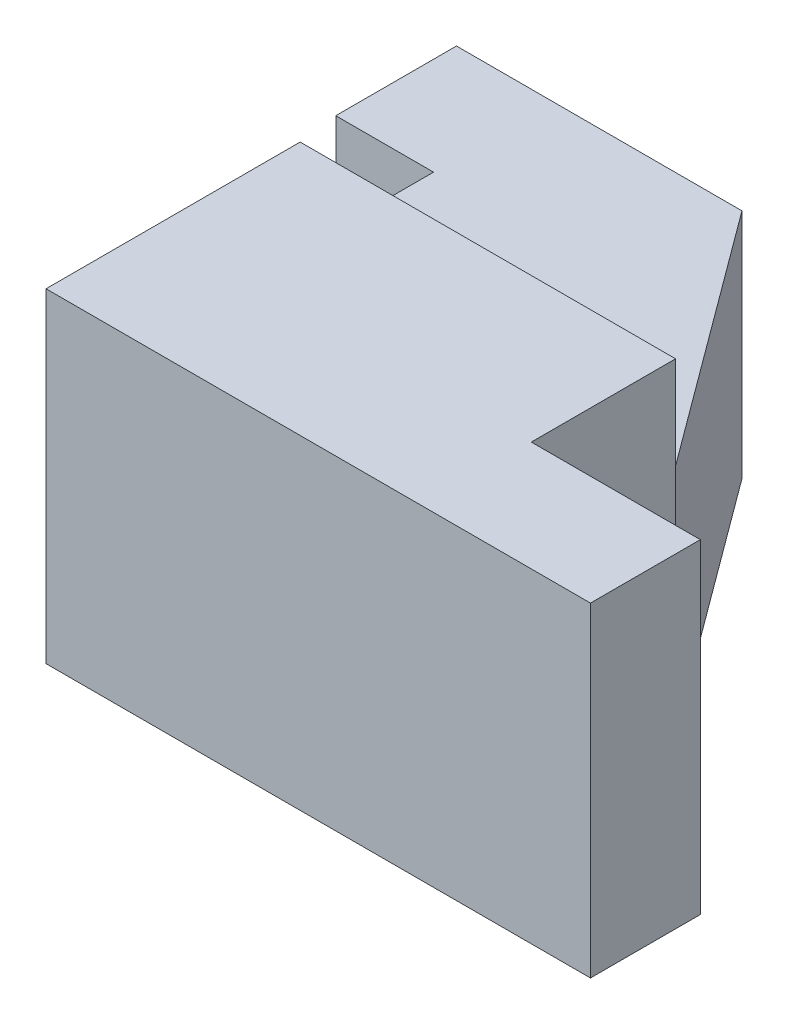
from build123d import *

# Parameters (mm, degrees)
BOSS_EXTRUDE1_DEPTH = 35
CUT_EXTRUDE1_DEPTH  = 10
BOSS_EXTRUDE2_DEPTH = 1


with BuildPart() as part:
    # Sketch1 → Boss-Extrude1 (new body)
    with BuildSketch(Plane(origin=(0, 0, 0), x_dir=(1, 0, 0), z_dir=(0, 1, 0))):
        Polygon((20.234168998, 54.781898059), (40.468337996, 27.39094903), (40.468337996, 11.84121787), (58.685596258, 11.84121787), (58.685596258, 0), (40.468337996, 0), (0, 0), (0, 41.769570729), (-10.539985137, 41.769570729), (-10.539985137, 54.781898059), (0, 54.781898059), align=None)
    extrude(amount=BOSS_EXTRUDE1_DEPTH)

    # Sketch2 → Cut-Extrude1 (cut)
    with BuildSketch(Plane(origin=(0, 35, 0), x_dir=(1, 0, 0), z_dir=(0, 1, 0))):
        Polygon((0, 27.39094903), (40.468337996, 27.39094903), (20.234168998, 54.781898059), (-10.539985137, 54.781898059), (-10.539985137, 41.769570729), (0, 41.769570729), align=None)
    extrude(amount=-CUT_EXTRUDE1_DEPTH, mode=Mode.SUBTRACT)

    # Sketch3 → Boss-Extrude2 (add)
    # profile 1 of 5: a face of its own
    with BuildSketch(Plane(origin=(40.468337996, 0, 0), x_dir=(0, 0, -1), z_dir=(1, 0, 0))):
        with BuildLine():
            Line((15.608012498, 25.318181818), (15.608012498, 26.3828125))
            add(Edge.make_bspline(
                [(15.608012498, 26.3828125), (15.613929091, 26.382309841), (15.628116005, 26.381104557), (15.652752461, 26.379888269), (15.684222971, 26.378149071), (15.722625164, 26.378258693), (15.767786844, 26.375208573), (15.819899458, 26.374332347), (15.878605829, 26.372746951), (15.967150762, 26.370972432), (16.08479696, 26.368081076), (16.23159955, 26.367557497), (16.383808007, 26.364605676), (16.538173624, 26.364195548), (16.686375461, 26.364664625), (16.821079515, 26.363412518), (16.938031542, 26.363679868), (17.01023791, 26.363650051), (17.043381816, 26.363636364)],
                knots=[0, 0, 0, 0, 0.198513801, 0.475999959, 0.824631156, 1.252128674, 1.759261781, 2.337292839, 2.994450419, 3.72282672, 5.298282345, 6.928903492, 8.630850825, 10.388057171, 12.089838844, 13.585844603, 14.891863097, 16, 16, 16, 16], degree=3))
            Line((17.043381816, 26.363636364), (17.698921589, 26.363636364))
            add(Edge.make_bspline(
                [(17.698921589, 26.363636364), (17.704840392, 26.363611169), (17.723072582, 26.36353356), (17.76023087, 26.364837574), (17.816828997, 26.363807194), (17.892803317, 26.366390766), (17.9882264, 26.366186183), (18.103274734, 26.368157778), (18.237983929, 26.369348265), (18.385946795, 26.370841938), (18.534393627, 26.371755913), (18.670744339, 26.37441097), (18.788649329, 26.375540632), (18.88808028, 26.377009351), (18.969049823, 26.378340257), (19.031783254, 26.3798237), (19.076073912, 26.380900137), (19.09949142, 26.38230229), (19.108012498, 26.3828125)],
                knots=[0, 0, 0, 0, 0.201587442, 0.620966849, 1.266046664, 2.128991623, 3.209530401, 4.515916572, 6.04806601, 7.797919325, 9.555835797, 11.10421633, 12.442854094, 13.571858957, 14.491239148, 15.201010182, 15.709266456, 16, 16, 16, 16], degree=3))
            add(Edge.make_bspline(
                [(19.108012498, 26.3828125), (19.107969078, 26.37570966), (19.107869193, 26.359370093), (19.108851628, 26.332151941), (19.109506877, 26.299007437), (19.110028585, 26.259934426), (19.111708231, 26.214729417), (19.113074993, 26.163591481), (19.114309944, 26.1067611), (19.117455901, 26.021305234), (19.121628692, 25.905299307), (19.127075683, 25.756604322), (19.134707274, 25.596371983), (19.143433747, 25.369509378), (19.157714184, 25.084278816), (19.170826437, 24.804668089), (19.181725763, 24.595896407), (19.187900945, 24.460221055), (19.193557613, 24.343978911), (19.197248338, 24.272963201), (19.198921589, 24.240767045)],
                knots=[0, 0, 0, 0, 0.178876762, 0.411492983, 0.685835487, 1.013830418, 1.395620461, 1.825090285, 2.302244024, 2.827254007, 3.978784499, 5.225871867, 6.574728645, 8.018899266, 10.943769838, 13.767392392, 15.06888389, 16.208996219, 17.188018586, 18, 18, 18, 18], degree=3))
            Line((19.198921589, 24.240767045), (18.380739771, 24.221590909))
            Line((18.380739771, 24.221590909), (18.357302271, 25.323153409))
            Line((18.357302271, 25.323153409), (17.608012498, 25.323153409))
            add(Edge.make_bspline(
                [(17.608012498, 25.323153409), (17.608227716, 25.310132206), (17.608713002, 25.280771151), (17.610071671, 25.231749785), (17.612998825, 25.17303214), (17.617430034, 25.105110077), (17.622409317, 25.028895271), (17.627634379, 24.944874649), (17.631373164, 24.853204215), (17.638554664, 24.718547362), (17.646203654, 24.538390311), (17.650992216, 24.391339688), (17.653467043, 24.315340909)],
                knots=[0, 0, 0, 0, 0.387240677, 0.873175431, 1.458138368, 2.135256309, 2.897125796, 3.729256101, 4.638343155, 5.625114967, 7.738969684, 10, 10, 10, 10], degree=3))
            Line((17.653467043, 24.315340909), (16.871506816, 24.300426136))
            Line((16.871506816, 24.300426136), (16.880739771, 25.323153409))
            Line((16.880739771, 25.323153409), (16.454603407, 25.323153409))
            add(Edge.make_bspline(
                [(16.454603407, 25.323153409), (16.384527377, 25.322477791), (16.245795629, 25.321140248), (16.037469323, 25.318520595), (15.825342018, 25.318090537), (15.681875989, 25.318150794), (15.608012498, 25.318181818)],
                knots=[0, 0, 0, 0, 0.993312589, 1.966492553, 2.953048609, 4, 4, 4, 4], degree=3))
        make_face()
    # profile 2 of 5: a face of its own
    with BuildSketch(Plane(origin=(40.468337996, 0, 0), x_dir=(0, 0, -1), z_dir=(1, 0, 0))):
        with BuildLine():
            Line((18.44608068, 22.386363636), (17.125057952, 22.386363636))
            add(Edge.make_bspline(
                [(17.125057952, 22.386363636), (17.110379654, 22.38640637), (17.076286679, 22.386505625), (17.017815078, 22.385489559), (16.945134375, 22.384881026), (16.857298472, 22.384338381), (16.752901761, 22.382577283), (16.62978839, 22.381492136), (16.487276847, 22.379043174), (16.332207621, 22.37713232), (16.177847778, 22.375254105), (16.037706086, 22.372696267), (15.917895944, 22.371939872), (15.818482758, 22.369252938), (15.738687842, 22.36815591), (15.678323163, 22.366643509), (15.636869331, 22.365583653), (15.615586379, 22.364147457), (15.608012498, 22.363636364)],
                knots=[0, 0, 0, 0, 0.464352648, 1.078542139, 1.850003055, 2.763759928, 3.85733811, 5.15311837, 6.658687364, 8.366454592, 10.059244011, 11.542346869, 12.800681911, 13.849460857, 14.688425178, 15.32521388, 15.759866476, 16, 16, 16, 16], degree=3))
            Line((15.608012498, 22.363636364), (15.608012498, 23.418323864))
            add(Edge.make_bspline(
                [(15.608012498, 23.418323864), (15.616059166, 23.417780679), (15.638047076, 23.4162964), (15.680232853, 23.416443808), (15.74057336, 23.414238084), (15.819189808, 23.414157073), (15.916012704, 23.413231855), (16.030834624, 23.412616103), (16.163883288, 23.411859275), (16.310900929, 23.41128959), (16.464071906, 23.410229776), (16.615352931, 23.410856376), (16.760473204, 23.409464615), (16.899443943, 23.410138939), (17.03225359, 23.408827799), (17.159149035, 23.409156032), (17.279887458, 23.409075961), (17.358249227, 23.409086018), (17.396364771, 23.409090909)],
                knots=[0, 0, 0, 0, 0.216408101, 0.591345622, 1.13158176, 1.836900011, 2.701062017, 3.730423251, 4.918630878, 6.272039408, 7.676279084, 9.029672699, 10.332250126, 11.571272449, 12.759480077, 13.89683903, 14.977012338, 16, 16, 16, 16], degree=3))
            Line((17.396364771, 23.409090909), (17.796932952, 23.409090909))
            add(Edge.make_bspline(
                [(17.796932952, 23.409090909), (17.817766627, 23.409022397), (17.862276115, 23.408876027), (17.933057015, 23.410135242), (18.01237086, 23.409511854), (18.099725289, 23.410690929), (18.195611989, 23.410981924), (18.29953114, 23.413008179), (18.411994531, 23.413086128), (18.529175489, 23.414911221), (18.644006532, 23.415853704), (18.749112936, 23.4182343), (18.840972717, 23.420254651), (18.91980287, 23.422498998), (18.985649514, 23.424212173), (19.03819009, 23.427242522), (19.077533458, 23.429730396), (19.099258627, 23.432231036), (19.108012498, 23.433238636)],
                knots=[0, 0, 0, 0, 0.762450879, 1.628915652, 2.590643466, 3.665041004, 4.82607808, 6.099835492, 7.468808806, 8.941827206, 10.388854792, 11.671421955, 12.789407829, 13.751486831, 14.557677909, 15.199765774, 15.67755616, 16, 16, 16, 16], degree=3))
            add(Edge.make_bspline(
                [(19.108012498, 23.433238636), (19.107959504, 23.33759362), (19.107856923, 23.152454224), (19.104712869, 22.883986257), (19.100816069, 22.633967568), (19.094420097, 22.402418027), (19.086181418, 22.189306422), (19.07516778, 21.994385842), (19.060385745, 21.817739732), (19.047877759, 21.706178581), (19.041961362, 21.653409091)],
                knots=[0, 0, 0, 0, 1.288127471, 2.493419436, 3.615907917, 4.655730358, 5.613022645, 6.488139192, 7.284875391, 8, 8, 8, 8], degree=3))
            add(Edge.make_bspline(
                [(19.041961362, 21.653409091), (19.033703622, 21.596224803), (19.017751147, 21.485754987), (18.982603691, 21.327547494), (18.940679578, 21.182177965), (18.889666365, 21.050445932), (18.831150591, 20.932881819), (18.764933141, 20.829996722), (18.690929114, 20.742475925), (18.609257103, 20.670420276), (18.520305289, 20.613800435), (18.423438036, 20.574869315), (18.320018984, 20.549403634), (18.248318619, 20.546789448), (18.21170568, 20.545454545)],
                knots=[0, 0, 0, 0, 1.365922432, 2.638717827, 3.829198653, 4.940607994, 5.974660658, 6.929670627, 7.827188068, 8.676177892, 9.496323936, 10.307265251, 11.135625128, 12, 12, 12, 12], degree=3))
            add(Edge.make_bspline(
                [(18.21170568, 20.545454545), (18.187779635, 20.546110163), (18.14053595, 20.547404727), (18.070434856, 20.554408428), (18.002183642, 20.56704426), (17.935966489, 20.586041982), (17.871032952, 20.608604955), (17.807501605, 20.636370338), (17.745829958, 20.66978044), (17.664809502, 20.72229462), (17.565483771, 20.799760436), (17.451391821, 20.909998586), (17.336695395, 21.035355456), (17.266971531, 21.129524355), (17.230881816, 21.178267045)],
                knots=[0, 0, 0, 0, 0.70860242, 1.399186127, 2.083909451, 2.760873109, 3.43711041, 4.118307733, 4.811519539, 5.51157439, 6.975533674, 8.532561923, 10.205222079, 12, 12, 12, 12], degree=3))
            add(Edge.make_bspline(
                [(17.230881816, 21.178267045), (17.225660708, 21.17354609), (17.213233377, 21.162309229), (17.192235652, 21.142579275), (17.165932369, 21.117747451), (17.134674649, 21.087676399), (17.097729617, 21.05313913), (17.055638177, 21.013077727), (17.008275546, 20.967874425), (16.957488043, 20.918988619), (16.906327735, 20.870253617), (16.859273766, 20.824009607), (16.816191944, 20.783541951), (16.778543641, 20.747323829), (16.746321328, 20.715619787), (16.718827155, 20.688900796), (16.696378276, 20.667076914), (16.676877677, 20.648465719), (16.657910589, 20.630016313), (16.635365065, 20.6095015), (16.609408987, 20.583334944), (16.577081961, 20.554152507), (16.541494135, 20.519157728), (16.500392266, 20.480733537), (16.455246386, 20.437321344), (16.406519896, 20.391598126), (16.358338934, 20.346022046), (16.31332966, 20.303911457), (16.273370541, 20.266687694), (16.238324545, 20.234498384), (16.208523823, 20.207474517), (16.183669016, 20.185452706), (16.16388124, 20.168278872), (16.152069538, 20.158826465), (16.147074998, 20.154829545)],
                knots=[0, 0, 0, 0, 0.453260903, 1.078855762, 1.855294354, 2.782600182, 3.871831201, 5.111919743, 6.52443217, 8.087824814, 9.651217459, 11.074302669, 12.335943427, 13.457240684, 14.43825364, 15.246803848, 15.926011208, 16.454327047, 16.982642886, 17.629784787, 18.416777542, 19.35516983, 20.433356532, 21.630341421, 22.978193347, 24.466418285, 25.933092985, 27.248924439, 28.435476401, 29.44968627, 30.313140472, 31.025906851, 31.58810781, 32, 32, 32, 32], degree=3))
            Line((16.147074998, 20.154829545), (15.471648862, 21.049005682))
            add(Edge.make_bspline(
                [(15.471648862, 21.049005682), (15.476852407, 21.052090382), (15.48918011, 21.059398334), (15.510456444, 21.071725659), (15.535696611, 21.089549943), (15.567405485, 21.108836882), (15.603572038, 21.133440926), (15.644922263, 21.161489538), (15.691699074, 21.193011129), (15.762984389, 21.242088753), (15.863148112, 21.310129742), (15.994273987, 21.400480476), (16.140624651, 21.500558862), (16.297507552, 21.607569837), (16.455728323, 21.715886786), (16.605788518, 21.819846967), (16.744682703, 21.913852215), (16.870260561, 22.000800953), (16.983720357, 22.078948538), (17.085282169, 22.147845931), (17.174680993, 22.207650368), (17.230607367, 22.243902098), (17.256449998, 22.260653409)],
                knots=[0, 0, 0, 0, 0.168252897, 0.398607381, 0.683485362, 1.026877551, 1.430454691, 1.899787115, 2.416597896, 2.999182639, 4.30678114, 5.784265691, 7.427915257, 9.237732375, 11.065853569, 12.760705164, 14.314837979, 15.730266824, 17.008695889, 18.146418312, 19.143491246, 20, 20, 20, 20], degree=3))
            add(Edge.make_bspline(
                [(17.256449998, 22.260653409), (17.284176368, 22.21638909), (17.341678798, 22.124588187), (17.42565576, 22.015962858), (17.499952535, 21.930377744), (17.562740519, 21.872614024), (17.626797546, 21.818065883), (17.694753232, 21.770539789), (17.765038044, 21.73109361), (17.837756767, 21.703223746), (17.911573223, 21.685051911), (17.961602768, 21.682894542), (17.986563634, 21.681818182)],
                knots=[0, 0, 0, 0, 1.612164336, 3.34350889, 4.234197125, 5.108257032, 5.975070848, 6.830962957, 7.66535157, 8.456905229, 9.230115291, 10, 10, 10, 10], degree=3))
            add(Edge.make_bspline(
                [(17.986563634, 21.681818182), (18.002444608, 21.682488866), (18.033886054, 21.683816698), (18.080041479, 21.690583862), (18.124205757, 21.703654823), (18.165831408, 21.722430422), (18.206331881, 21.745014164), (18.243912454, 21.774112452), (18.280254561, 21.80720654), (18.31383616, 21.846048185), (18.344840196, 21.890500999), (18.371672891, 21.941825998), (18.394205337, 22.000059785), (18.413576579, 22.064547444), (18.427098518, 22.136025911), (18.437950523, 22.213504541), (18.444081011, 22.297728658), (18.445396822, 22.356051767), (18.44608068, 22.386363636)],
                knots=[0, 0, 0, 0, 0.807394901, 1.598495405, 2.363559583, 3.139143183, 3.915006591, 4.713752514, 5.54803119, 6.409194542, 7.316825283, 8.296157079, 9.343807513, 10.485636333, 11.712384095, 13.03592979, 14.459504163, 16, 16, 16, 16], degree=3))
        make_face()
    # profile 3 of 5: a face of its own
    with BuildSketch(Plane(origin=(40.468337996, 0, 0), x_dir=(0, 0, -1), z_dir=(1, 0, 0))):
        with BuildLine():
            add(Edge.make_bspline(
                [(15.517103407, 18.03125), (15.517940274, 18.08170112), (15.519581106, 18.180619881), (15.531899652, 18.325757517), (15.551675816, 18.464995031), (15.579308171, 18.598038922), (15.613952583, 18.725680708), (15.657471299, 18.846772791), (15.7076418, 18.962425734), (15.766320576, 19.071253818), (15.830881112, 19.173468497), (15.898919359, 19.270079483), (15.972421507, 19.359219588), (16.0507434, 19.441269066), (16.132099585, 19.518097838), (16.21946252, 19.586107535), (16.31049671, 19.648142505), (16.405429851, 19.703466149), (16.503324102, 19.751278659), (16.602139802, 19.79338159), (16.70193601, 19.829128496), (16.802563413, 19.858082926), (16.904030092, 19.881040328), (17.006468421, 19.897579935), (17.109979433, 19.906634536), (17.179256209, 19.908273036), (17.213836362, 19.909090909)],
                knots=[0, 0, 0, 0, 1.28183837, 2.513281471, 3.698361429, 4.853378881, 5.96399271, 7.056157584, 8.120176888, 9.164422389, 10.194238543, 11.190747931, 12.165095003, 13.126768987, 14.071702403, 15.005579982, 15.936605072, 16.869319423, 17.79478913, 18.703169829, 19.597458161, 20.486572167, 21.362213815, 22.239445119, 23.121202505, 24, 24, 24, 24], degree=3))
            add(Edge.make_bspline(
                [(17.213836362, 19.909090909), (17.275234416, 19.907399981), (17.397818268, 19.904023969), (17.580681341, 19.878267852), (17.761288551, 19.836348194), (17.939028571, 19.777818513), (18.112166223, 19.704234302), (18.276994462, 19.611418833), (18.433946478, 19.503406843), (18.556255733, 19.399329135), (18.648358484, 19.308042492), (18.71501133, 19.235446403), (18.776992423, 19.157899127), (18.836612889, 19.076923535), (18.890970143, 18.990645956), (18.94217436, 18.90035625), (18.989889922, 18.805917285), (19.032995438, 18.707183691), (19.072189457, 18.60490861), (19.106438945, 18.499022437), (19.134638764, 18.389358881), (19.158045657, 18.276299611), (19.176648725, 18.159966772), (19.189165631, 18.039990366), (19.197180448, 17.916775733), (19.198337163, 17.833345837), (19.198921589, 17.791193182)],
                knots=[0, 0, 0, 0, 1.359376484, 2.714053505, 4.081213128, 5.460652739, 6.853349966, 8.240519594, 9.642492163, 11.067036843, 11.789972542, 12.513668307, 13.248146964, 13.987474949, 14.739429328, 15.504843748, 16.285636076, 17.081491963, 17.889669369, 18.710402, 19.544605276, 20.395996977, 21.266576569, 22.152430652, 23.066522233, 24, 24, 24, 24], degree=3))
            add(Edge.make_bspline(
                [(19.198921589, 17.791193182), (19.197666278, 17.720584891), (19.195208202, 17.582323865), (19.172826641, 17.38041171), (19.136159889, 17.188846136), (19.08434078, 17.008498714), (19.019315358, 16.839678757), (18.940495123, 16.68357516), (18.846631689, 16.541651702), (18.740566926, 16.412039825), (18.620896599, 16.29667805), (18.488039387, 16.195563002), (18.342579266, 16.108946862), (18.185315473, 16.036340608), (18.016685799, 15.979573189), (17.838106587, 15.938393439), (17.649164534, 15.914065961), (17.520015798, 15.910775557), (17.45389318, 15.909090909)],
                knots=[0, 0, 0, 0, 1.16585083, 2.282900924, 3.350337473, 4.383693547, 5.377746439, 6.33427132, 7.265832067, 8.182503293, 9.095045688, 10.004550602, 10.93395893, 11.88567672, 12.860024833, 13.867308716, 14.908087409, 16, 16, 16, 16], degree=3))
            add(Edge.make_bspline(
                [(17.45389318, 15.909090909), (17.402219324, 15.910551139), (17.297297333, 15.913516086), (17.13841241, 15.935160657), (16.976134922, 15.969558722), (16.811312555, 16.016377912), (16.647096968, 16.0793714), (16.487074838, 16.159921788), (16.332162918, 16.257601896), (16.207781377, 16.351090544), (16.112551434, 16.435764182), (16.043792535, 16.505092059), (15.978898858, 16.580342219), (15.917044611, 16.660745699), (15.858247452, 16.74657286), (15.802614157, 16.83776323), (15.75100331, 16.934412689), (15.702526855, 17.03616061), (15.658235565, 17.143016506), (15.621010431, 17.255454689), (15.58876115, 17.372512633), (15.562693287, 17.494672025), (15.542177778, 17.6219707), (15.527226265, 17.753963194), (15.518697535, 17.890983993), (15.517641658, 17.983889729), (15.517103407, 18.03125)],
                knots=[0, 0, 0, 0, 1.153726157, 2.342601393, 3.57440572, 4.856137659, 6.164886377, 7.495996181, 8.849913256, 10.249867543, 10.965067063, 11.694046249, 12.42862093, 13.182573326, 13.958305526, 14.750755785, 15.566786036, 16.40391613, 17.266890041, 18.147941351, 19.047017458, 19.97714216, 20.935811673, 21.925397031, 22.942436042, 24, 24, 24, 24], degree=3))
        make_face()
        with BuildLine():
            add(Edge.make_bspline(
                [(16.28983068, 17.9765625), (16.291116932, 17.933811367), (16.293634162, 17.85014625), (16.319698973, 17.728993837), (16.360044769, 17.615352415), (16.41727662, 17.510362121), (16.490234676, 17.414877143), (16.579571206, 17.331215163), (16.683804296, 17.259085271), (16.802981991, 17.198539637), (16.936740559, 17.150328195), (17.085406333, 17.117038362), (17.247535346, 17.095384361), (17.360542495, 17.092436429), (17.419092043, 17.090909091)],
                knots=[0, 0, 0, 0, 0.949481319, 1.858160486, 2.742520531, 3.6236775, 4.50615479, 5.403768841, 6.334153748, 7.316072402, 8.36866591, 9.487453869, 10.69823774, 12, 12, 12, 12], degree=3))
            add(Edge.make_bspline(
                [(17.419092043, 17.090909091), (17.458404396, 17.091695514), (17.534772139, 17.093223212), (17.645909925, 17.102009015), (17.749493304, 17.118645263), (17.846207083, 17.14000731), (17.935298391, 17.169628069), (18.017903548, 17.204162387), (18.09385015, 17.244613529), (18.1623221, 17.291725157), (18.223753088, 17.344573606), (18.27810675, 17.402421484), (18.323149496, 17.466906067), (18.361012587, 17.535565126), (18.389988073, 17.60944569), (18.411737682, 17.68715259), (18.423584836, 17.769285188), (18.425314975, 17.825249414), (18.426194316, 17.853693182)],
                knots=[0, 0, 0, 0, 1.323040814, 2.570124481, 3.747579329, 4.851049144, 5.899061945, 6.902241681, 7.861040494, 8.789130643, 9.69297001, 10.583653176, 11.452331861, 12.332910808, 13.216080545, 14.116719351, 15.042824278, 16, 16, 16, 16], degree=3))
            add(Edge.make_bspline(
                [(18.426194316, 17.853693182), (18.42514485, 17.886912744), (18.42308394, 17.95214836), (18.405614614, 18.047183319), (18.377029557, 18.137219638), (18.336812227, 18.221483376), (18.288129118, 18.30087253), (18.228814837, 18.372605124), (18.162976475, 18.439438287), (18.087457301, 18.497938392), (18.006060823, 18.551522609), (17.917469713, 18.597354129), (17.823577475, 18.63740214), (17.723946589, 18.669882557), (17.619899653, 18.695214024), (17.512168702, 18.713610953), (17.401129851, 18.725492444), (17.325846173, 18.726674022), (17.287699998, 18.727272727)],
                knots=[0, 0, 0, 0, 0.995052497, 1.954055351, 2.885355509, 3.818600041, 4.746026368, 5.669180887, 6.602452395, 7.552195931, 8.526435441, 9.519892673, 10.537362681, 11.583045513, 12.656973621, 13.74422849, 14.857002533, 16, 16, 16, 16], degree=3))
            add(Edge.make_bspline(
                [(17.287699998, 18.727272727), (17.236984718, 18.726038739), (17.138750156, 18.723648527), (16.996752123, 18.705495183), (16.866005295, 18.673561701), (16.746942138, 18.629476179), (16.639881502, 18.575301094), (16.546794912, 18.510285613), (16.467340119, 18.436383369), (16.402359107, 18.353924748), (16.353107882, 18.264611047), (16.315733108, 18.172114094), (16.293955922, 18.075343768), (16.291209276, 18.009573767), (16.28983068, 17.9765625)],
                knots=[0, 0, 0, 0, 1.307009708, 2.531653726, 3.681609407, 4.768627752, 5.797501532, 6.765819063, 7.685379574, 8.585045165, 9.459269499, 10.305729446, 11.149612041, 12, 12, 12, 12], degree=3))
        make_face(mode=Mode.SUBTRACT)
    # profile 4 of 5: a face of its own
    with BuildSketch(Plane(origin=(40.468337996, 0, 0), x_dir=(0, 0, -1), z_dir=(1, 0, 0))):
        with BuildLine():
            Line((15.608012498, 14.364346591), (15.64139318, 15.363636364))
            add(Edge.make_bspline(
                [(15.64139318, 15.363636364), (15.64754927, 15.363173016), (15.66246881, 15.362050075), (15.688482265, 15.359778566), (15.722110343, 15.357728437), (15.76308957, 15.355789551), (15.81138439, 15.352906577), (15.866988743, 15.349100751), (15.930233929, 15.345901436), (16.002398249, 15.341135576), (16.085788204, 15.337417201), (16.182786383, 15.331005235), (16.295067888, 15.326060931), (16.422374555, 15.318289416), (16.564715201, 15.311823654), (16.721876592, 15.302860727), (16.894233716, 15.293790537), (17.077941546, 15.284002741), (17.264962822, 15.274191542), (17.447752414, 15.265195694), (17.622444238, 15.255735711), (17.789110674, 15.247200691), (17.947517429, 15.239667769), (18.097581867, 15.231497537), (18.239421729, 15.224765382), (18.373151517, 15.21732441), (18.499121499, 15.211143255), (18.617498924, 15.204839845), (18.728260345, 15.198092933), (18.831307342, 15.193000542), (18.926656292, 15.186134084), (19.014485715, 15.180431492), (19.095042281, 15.175914977), (19.146134945, 15.171737496), (19.170512498, 15.169744318)],
                knots=[0, 0, 0, 0, 0.167676778, 0.406371642, 0.709201878, 1.082646866, 1.520650238, 2.0232283, 2.596410566, 3.240578038, 3.987468014, 4.863474759, 5.880733751, 7.039938482, 8.32756719, 9.750715039, 11.315466379, 13.015400921, 14.747441742, 16.402093077, 17.98610754, 19.4991524, 20.934810566, 22.293406424, 23.581035132, 24.791604912, 25.931204891, 27.006591682, 28.011356954, 28.945141018, 29.808717123, 30.607708537, 31.335703875, 32, 32, 32, 32], degree=3))
            Line((19.170512498, 15.169744318), (19.198921589, 15.119318182))
            add(Edge.make_bspline(
                [(19.198921589, 15.119318182), (19.181633863, 15.095884806), (19.145652996, 15.047113023), (19.089601852, 14.970900472), (19.028444443, 14.889457884), (18.963080039, 14.802118315), (18.893804906, 14.70888944), (18.818601278, 14.611059704), (18.74039616, 14.506471567), (18.65786716, 14.399459306), (18.576231018, 14.292837688), (18.498982137, 14.190496295), (18.426900865, 14.09528378), (18.358573336, 14.00805194), (18.297632641, 13.9262565), (18.240453502, 13.852612704), (18.189191079, 13.785529779), (18.126382808, 13.703253689), (18.046352746, 13.599874611), (17.946761062, 13.467046907), (17.8355907, 13.32369984), (17.739251487, 13.196905876), (17.660458103, 13.093890297), (17.603331101, 13.020027282), (17.550647438, 12.950448951), (17.500123261, 12.886441754), (17.454753701, 12.826168966), (17.411599449, 12.771425932), (17.372827017, 12.72101131), (17.347854296, 12.68914032), (17.335995452, 12.674005682)],
                knots=[0, 0, 0, 0, 0.795699866, 1.656086663, 2.585020285, 3.578642756, 4.636954084, 5.758686611, 6.95026262, 8.205294126, 9.451256907, 10.61955005, 11.70893892, 12.714305286, 13.647127416, 14.495909, 15.261865009, 15.954066554, 17.324265588, 18.834124659, 20.490274414, 22.280930696, 23.185326978, 24.034108562, 24.832407431, 25.569974464, 26.262176009, 26.893647116, 27.474624103, 28, 28, 28, 28], degree=3))
            add(Edge.make_bspline(
                [(17.335995452, 12.674005682), (17.370323051, 12.674023419), (17.441582411, 12.67406024), (17.552379466, 12.67376096), (17.670747642, 12.675018582), (17.837418135, 12.674379429), (18.047171811, 12.676161913), (18.254796117, 12.677697626), (18.415068295, 12.679608695), (18.528463169, 12.681273825), (18.635948625, 12.681764529), (18.76923432, 12.68269976), (18.925954505, 12.684305682), (19.048826467, 12.684064863), (19.108012498, 12.683948864)],
                knots=[0, 0, 0, 0, 0.697377994, 1.447660525, 2.250861994, 3.102144097, 4.833592042, 6.512170744, 7.32022457, 8.089805231, 8.816056171, 9.503831974, 10.797624148, 12, 12, 12, 12], degree=3))
            Line((19.108012498, 12.683948864), (19.081734089, 11.681818182))
            add(Edge.make_bspline(
                [(19.081734089, 11.681818182), (19.022781424, 11.685787675), (18.906289968, 11.693631459), (18.757896418, 11.704450081), (18.629287379, 11.712609422), (18.511935411, 11.721697471), (18.372921617, 11.730506132), (18.245546863, 11.738919483), (18.13950598, 11.746308649), (18.063994461, 11.751437756), (17.995059872, 11.755262683), (17.932635899, 11.760296176), (17.876659979, 11.762120535), (17.827519289, 11.766626494), (17.785077411, 11.768140434), (17.746985757, 11.770688828), (17.708615048, 11.772753452), (17.665323526, 11.775886109), (17.614864597, 11.778419642), (17.557343739, 11.782106737), (17.492707654, 11.786290151), (17.420772618, 11.791547948), (17.34166243, 11.796172096), (17.286513311, 11.799906861), (17.257870452, 11.801846591)],
                knots=[0, 0, 0, 0, 2.133500422, 4.215832645, 5.372424945, 6.786632107, 8.465794967, 10.401978326, 11.395945206, 12.304046614, 13.134823775, 13.888827282, 14.565014015, 15.156398484, 15.669941714, 16.098129129, 16.534849873, 17.057420646, 17.665317708, 18.359054026, 19.138645208, 20.004102219, 20.963388358, 22, 22, 22, 22], degree=3))
            add(Edge.make_bspline(
                [(17.257870452, 11.801846591), (17.204367997, 11.80494767), (17.103760921, 11.810778999), (16.961954769, 11.818646899), (16.838848951, 11.825066314), (16.728514077, 11.830245806), (16.620063774, 11.835260468), (16.501980546, 11.842180414), (16.368423737, 11.848141799), (16.249116688, 11.854047633), (16.151088962, 11.858446057), (16.081511863, 11.862284423), (16.017569454, 11.864893632), (15.959328885, 11.867720629), (15.907028649, 11.870698368), (15.860392222, 11.872945628), (15.819653976, 11.874124087), (15.752656209, 11.877000801), (15.660300567, 11.880990081), (15.579599128, 11.885568303), (15.540540907, 11.887784091)],
                knots=[0, 0, 0, 0, 1.68303769, 3.16481741, 4.460198397, 5.554349413, 6.633647931, 7.869633905, 9.268973177, 10.832046056, 11.62100894, 12.350565028, 13.020355727, 13.63073256, 14.181709417, 14.665484526, 15.096958033, 15.461565563, 16.771437837, 18, 18, 18, 18], degree=3))
            Line((15.540540907, 11.887784091), (15.517103407, 11.938210227))
            add(Edge.make_bspline(
                [(15.517103407, 11.938210227), (15.545117733, 11.979277192), (15.605081384, 12.067179544), (15.704438689, 12.205309667), (15.81609742, 12.360251863), (15.942454472, 12.529060016), (16.080367506, 12.71149224), (16.228641298, 12.905805503), (16.386398848, 13.110995134), (16.522618507, 13.287717853), (16.633997744, 13.430075393), (16.713945289, 13.534845677), (16.791317975, 13.63431561), (16.866232562, 13.728373387), (16.936387509, 13.819066957), (17.003756078, 13.904663528), (17.067639932, 13.985658749), (17.127607033, 14.061123333), (17.182501789, 14.129850892), (17.230529837, 14.190905694), (17.271975392, 14.242789298), (17.305915784, 14.285995316), (17.332906246, 14.320509447), (17.353709733, 14.345543035), (17.366395616, 14.362618205), (17.372456907, 14.370973205), (17.374347725, 14.373579545)],
                knots=[0, 0, 0, 0, 1.168415699, 2.500951541, 3.999119114, 5.657353984, 7.456930593, 9.374525833, 11.402369857, 13.540483689, 14.619052684, 15.650786435, 16.63809202, 17.581010576, 18.477053041, 19.333084577, 20.141300482, 20.901707316, 21.598672565, 22.208742423, 22.727557004, 23.159479536, 23.500144229, 23.757378954, 23.92431441, 24, 24, 24, 24], degree=3))
            add(Edge.make_bspline(
                [(17.374347725, 14.373579545), (17.295986326, 14.373026596), (17.132162518, 14.371870589), (16.876003004, 14.371692245), (16.598780355, 14.369824587), (16.358485386, 14.369048828), (16.16743611, 14.367641315), (16.038171876, 14.36817997), (15.925484055, 14.3671553), (15.829602181, 14.366678441), (15.750533775, 14.365505638), (15.688264927, 14.366035628), (15.642573182, 14.365223796), (15.617718641, 14.364592948), (15.608012498, 14.364346591)],
                knots=[0, 0, 0, 0, 1.597101275, 3.338929819, 5.220701171, 7.247220495, 8.236355481, 9.114503898, 9.881692688, 10.533084384, 11.068680153, 11.493279388, 11.802116524, 12, 12, 12, 12], degree=3))
        make_face()
    # profile 5 of 5: a face of its own
    with BuildSketch(Plane(origin=(40.468337996, 0, 0), x_dir=(0, 0, -1), z_dir=(1, 0, 0))):
        with BuildLine():
            Line((15.608012498, 9.136363636), (15.608012498, 10.241477273))
            add(Edge.make_bspline(
                [(15.608012498, 10.241477273), (15.620557828, 10.240922719), (15.651081448, 10.239573454), (15.705096249, 10.239733359), (15.775133011, 10.236615998), (15.860618128, 10.235799537), (15.959816969, 10.234482316), (16.071308469, 10.231888575), (16.194187695, 10.230890618), (16.328652293, 10.229128582), (16.474963744, 10.228729299), (16.633106985, 10.227979649), (16.803324136, 10.227074912), (16.920749115, 10.227205213), (16.981592043, 10.227272727)],
                knots=[0, 0, 0, 0, 0.32905589, 0.800614833, 1.415111181, 2.165920217, 3.040798427, 4.015033424, 5.088429307, 6.261086093, 7.539163447, 8.922710814, 10.405524224, 12, 12, 12, 12], degree=3))
            Line((16.981592043, 10.227272727), (18.278467043, 10.227272727))
            add(Edge.make_bspline(
                [(18.278467043, 10.227272727), (18.278251077, 10.253314522), (18.277770044, 10.311318888), (18.276457132, 10.407682651), (18.273254934, 10.522253893), (18.270237615, 10.649399766), (18.265506629, 10.776260029), (18.263212551, 10.8911086), (18.26011059, 10.987449149), (18.257308711, 11.090432851), (18.254859818, 11.203395086), (18.251148269, 11.290250925), (18.249347725, 11.332386364)],
                knots=[0, 0, 0, 0, 0.706704665, 1.574083359, 2.61514079, 3.816918436, 5.025305986, 6.059941064, 6.93402673, 7.640964959, 8.855586708, 10, 10, 10, 10], degree=3))
            Line((18.249347725, 11.332386364), (19.108012498, 11.332386364))
            add(Edge.make_bspline(
                [(19.108012498, 11.332386364), (19.107315827, 11.318418003), (19.105686336, 11.285746446), (19.102506849, 11.229671673), (19.100780721, 11.159329286), (19.098818113, 11.075040777), (19.095450505, 10.976816371), (19.094006229, 10.86457409), (19.090515915, 10.738176066), (19.088950279, 10.602507311), (19.086750488, 10.467328809), (19.084899383, 10.34232442), (19.082023074, 10.232256302), (19.082201929, 10.137064887), (19.080127319, 10.056823882), (19.079833395, 9.991474789), (19.078754876, 9.941053849), (19.078852742, 9.912405609), (19.07889318, 9.900568182)],
                knots=[0, 0, 0, 0, 0.468736577, 1.096360094, 1.882229957, 2.826727986, 3.9221402, 5.176007249, 6.588693641, 8.159892538, 9.723157912, 11.119821726, 12.349889836, 13.413134035, 14.309865868, 15.039877217, 15.603278137, 16, 16, 16, 16], degree=3))
            Line((19.07889318, 9.900568182), (19.07889318, 9.475142045))
            add(Edge.make_bspline(
                [(19.07889318, 9.475142045), (19.078893296, 9.474905306), (19.078894805, 9.47182769), (19.078744692, 9.463769288), (19.080057854, 9.448642983), (19.079230331, 9.426600377), (19.080754252, 9.397499436), (19.079997336, 9.361263538), (19.081194716, 9.31794712), (19.081791768, 9.267519964), (19.082257566, 9.209746552), (19.08429673, 9.144423754), (19.084083423, 9.071478736), (19.087212905, 8.990782252), (19.08787629, 8.902215972), (19.090429813, 8.80587475), (19.092450621, 8.701705772), (19.094501598, 8.593276236), (19.096500399, 8.487212796), (19.098661031, 8.390622329), (19.100643234, 8.307047572), (19.103069659, 8.236275902), (19.104303228, 8.178263544), (19.105545354, 8.133036245), (19.107213483, 8.100621455), (19.107791023, 8.083333944), (19.108012498, 8.076704545)],
                knots=[0, 0, 0, 0, 0.012185859, 0.158416166, 0.414609179, 0.792370806, 1.292139608, 1.913618413, 2.657055685, 3.52233748, 4.509467272, 5.630831172, 6.886033795, 8.263521046, 9.786948373, 11.444628347, 13.224139303, 15.149852048, 17.026830369, 18.684510343, 20.122906336, 21.329860146, 22.32939775, 23.109673436, 23.658578415, 24, 24, 24, 24], degree=3))
            Line((19.108012498, 8.076704545), (18.249347725, 8.076704545))
            add(Edge.make_bspline(
                [(18.249347725, 8.076704545), (18.249574732, 8.08238679), (18.250199105, 8.098015598), (18.251825336, 8.128063415), (18.253044211, 8.170924808), (18.254360135, 8.226804326), (18.256513726, 8.295223843), (18.259563808, 8.376648104), (18.262301363, 8.470876142), (18.264985317, 8.57433674), (18.267698085, 8.678980474), (18.270366809, 8.777233586), (18.273762, 8.865038124), (18.274752241, 8.94247503), (18.276176023, 9.009236919), (18.27777209, 9.065571596), (18.278584071, 9.111503258), (18.278502505, 9.138730878), (18.278467043, 9.150568182)],
                knots=[0, 0, 0, 0, 0.254087144, 0.698857584, 1.344449262, 2.169787768, 3.196323635, 4.402933336, 5.810415016, 7.408221049, 9.027175332, 10.487522905, 11.799850656, 12.953023425, 13.947560363, 14.783473223, 15.471110689, 16, 16, 16, 16], degree=3))
            Line((18.278467043, 9.150568182), (16.904887498, 9.150568182))
            add(Edge.make_bspline(
                [(16.904887498, 9.150568182), (16.84688542, 9.150642436), (16.734668639, 9.150786095), (16.572027995, 9.149785807), (16.420746031, 9.149369444), (16.280832894, 9.14785579), (16.152288811, 9.146002072), (16.035081793, 9.146191013), (15.929279069, 9.143265126), (15.83575622, 9.142212649), (15.756209706, 9.140785017), (15.692289472, 9.13937013), (15.644694011, 9.138140714), (15.618427955, 9.136868225), (15.608012498, 9.136363636)],
                knots=[0, 0, 0, 0, 1.609909869, 3.114697115, 4.514348467, 5.808914132, 6.998348724, 8.08259365, 9.061880128, 9.935930007, 10.678576158, 11.270117625, 11.710574799, 12, 12, 12, 12], degree=3))
        make_face()
    extrude(amount=BOSS_EXTRUDE2_DEPTH)


solid = part.part
